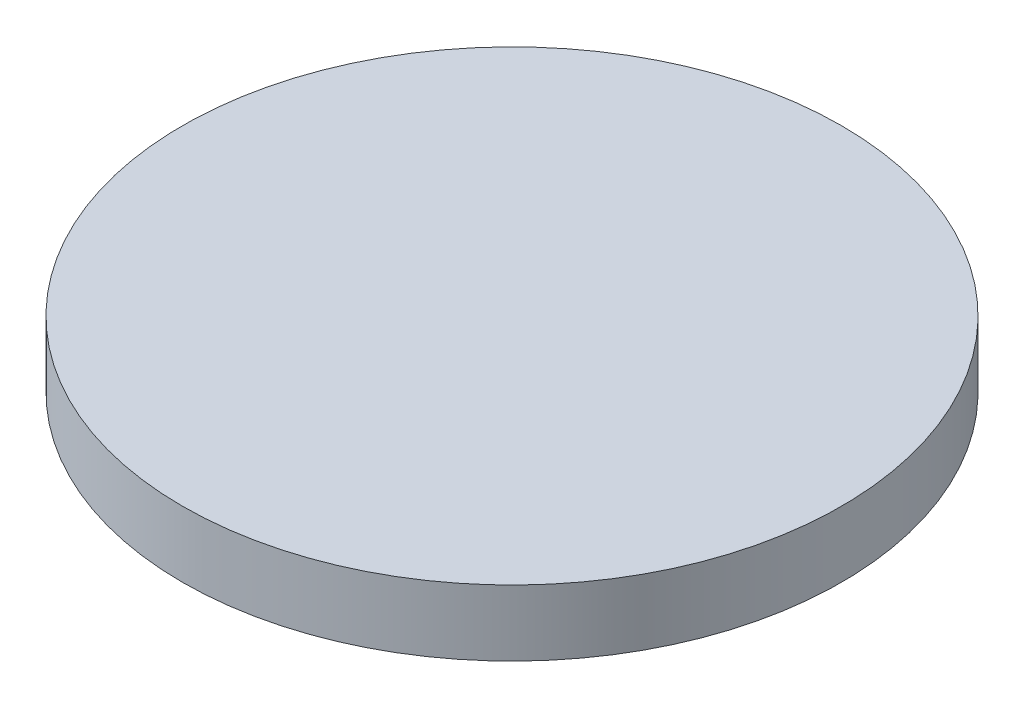
from build123d import *

# Parameters (mm, degrees)
SKETCH1_R           = 0.25
BOSS_EXTRUDE1_DEPTH = 0.05


with BuildPart() as part:
    # Sketch1 → Boss-Extrude1 (new body)
    with BuildSketch(Plane(origin=(0, 0, 0), x_dir=(1, 0, 0), z_dir=(0, 1, 0))):
        with Locations(Location((0, 0, 0), (0, 0, 270))):
            Circle(SKETCH1_R)
    extrude(amount=BOSS_EXTRUDE1_DEPTH)


solid = part.part
